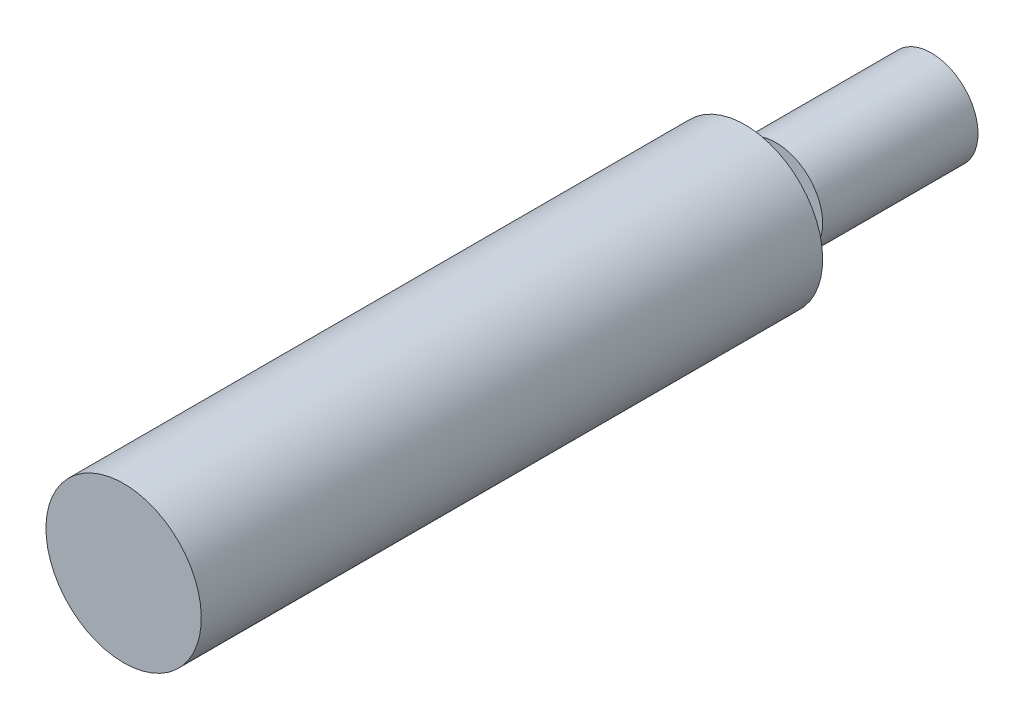
from build123d import *


with BuildPart() as part:
    # Sketch1 → Revolve1 (revolve)
    with BuildSketch(Plane.XZ):
        Polygon((0, 20), (2.5, 20), (2.5, 0), (1, 0), (1, -1), (1.5, -1), (1.5, -6), (0, -6), align=None)
    revolve(axis=Axis((0, 0, 44.681241357), (0, 0, -1)))


solid = part.part
